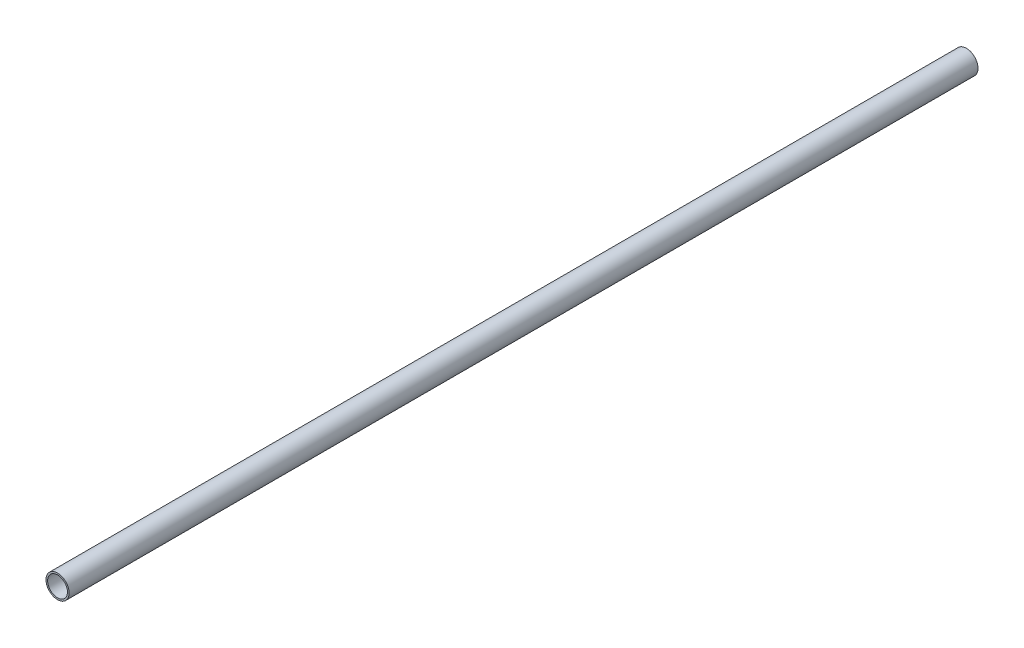
from build123d import *

# Parameters (mm, degrees)
SKETCH1_R           = 7
SKETCH1_R_2         = 6
BOSS_EXTRUDE1_DEPTH = 550


with BuildPart() as part:
    # Sketch1 → Boss-Extrude1 (new body)
    with BuildSketch(Plane.XY):
        Circle(SKETCH1_R)
        Circle(SKETCH1_R_2, mode=Mode.SUBTRACT)
    extrude(amount=BOSS_EXTRUDE1_DEPTH)


solid = part.part
